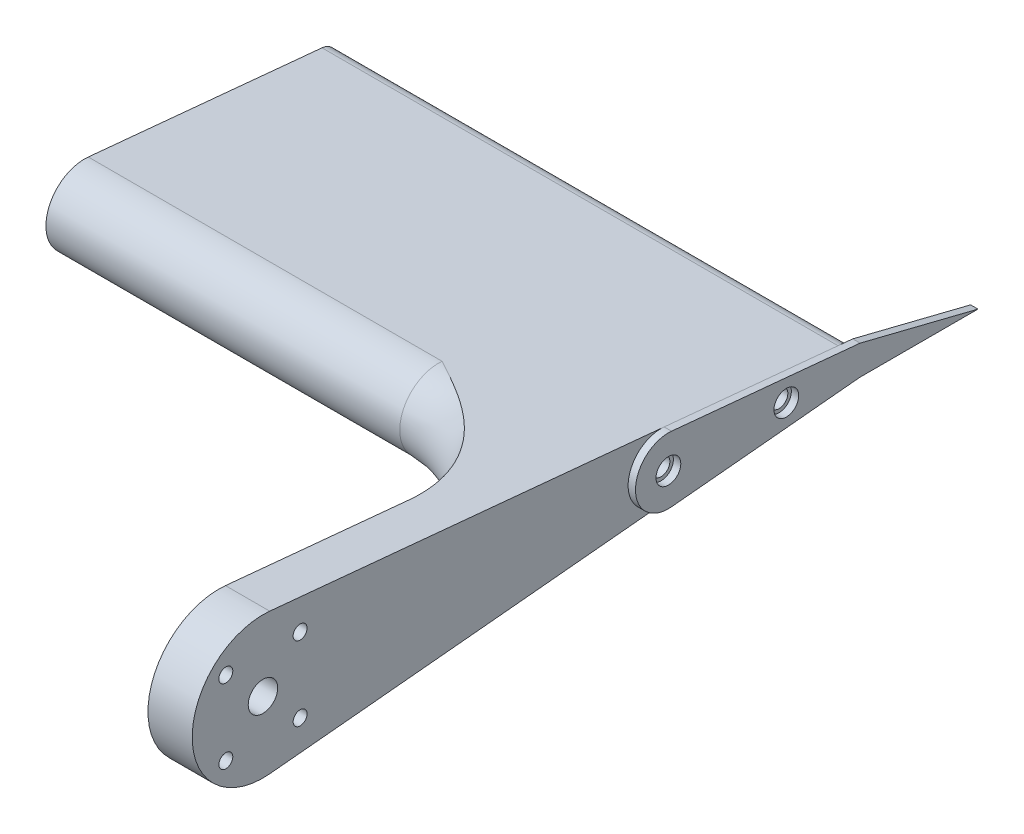
from build123d import *

# Parameters (mm, degrees)
SKETCH1_R           = 3.175
SKETCH1_R_2         = 1.4999999999999996
SKETCH1_R_3         = 1.4999999999999987
BOSS_EXTRUDE1_DEPTH = 4.7625
BOSS_EXTRUDE2_DEPTH = 101.6
SKETCH4_R           = 2.6669999999999963
BOSS_EXTRUDE3_DEPTH = 1.5875
SKETCH5_R           = 1.9050000000000071
CUT_EXTRUDE1_DEPTH  = 25.4
FILLET1_R           = 25.4


with BuildPart() as part:
    # Sketch1 → Boss-Extrude1 (new, symmetric)
    with BuildSketch(Plane(origin=(0, 0, 0), x_dir=(0, 0, -1), z_dir=(1, 0, 0))):
        with BuildLine():
            Line((1.449527282604434, 15.170908695822588), (123.83939402170368, 3.476984850542586))
            ThreePointArc((123.83939402170368, 3.476984850542586), (127.00000000000004, 0), (123.83939402170368, -3.476984850542586))
            Line((123.83939402170368, -3.476984850542586), (1.449527282604434, -15.170908695822588))
            ThreePointArc((1.449527282604434, -15.170908695822588), (-15.24, 1.87e-15), (1.449527282604434, 15.170908695822588))
        make_face()
        with Locations(Location((0, 0, 0), (0, 0, 180))):
            Circle(SKETCH1_R, mode=Mode.SUBTRACT)
        with Locations(Location((-8.000000000000005, 8.000000000000002, 0), (0, 0, 180))):
            Circle(SKETCH1_R_2, mode=Mode.SUBTRACT)
        with Locations(Location((7.999999999999998, 8.000000000000002, 0), (0, 0, 180))):
            Circle(SKETCH1_R_3, mode=Mode.SUBTRACT)
        with Locations(Location((7.999999999999998, -7.999999999999998, 0), (0, 0, 180))):
            Circle(SKETCH1_R_3, mode=Mode.SUBTRACT)
        with Locations(Location((-8.000000000000002, -7.999999999999998, 0), (0, 0, 180))):
            Circle(SKETCH1_R_2, mode=Mode.SUBTRACT)
    extrude(amount=BOSS_EXTRUDE1_DEPTH, both=True)

    # Sketch3 → Boss-Extrude2 (add)
    with BuildSketch(Plane.ZY.offset(4.7625)):
        with BuildLine():
            Line((-73.49895861991335, 8.286837443826865), (-123.83939402170368, 3.476984850542586))
            ThreePointArc((-123.83939402170368, 3.476984850542586), (-127.00000000000004, 4.3e-16), (-123.83939402170368, -3.476984850542586))
            Line((-123.83939402170368, -3.476984850542586), (-73.49895861991335, -8.286837443826865))
            ThreePointArc((-73.49895861991335, -8.286837443826865), (-64.38260294351677, 0), (-73.49895861991335, 8.286837443826865))
        make_face()
    extrude(amount=BOSS_EXTRUDE2_DEPTH)

    # Sketch5 → Cut-Extrude1 (cut)
    with BuildSketch(Plane(origin=(4.7625, 0, 0), x_dir=(0, 0, -1), z_dir=(1, 0, 0))):
        with Locations((85.72500000000001, 0)):
            Circle(SKETCH5_R)
        with Locations((111.125, 0)):
            Circle(SKETCH5_R)
    extrude(amount=-CUT_EXTRUDE1_DEPTH, mode=Mode.SUBTRACT)

    # Fillet1
    fillet1_edges = [part.edges().sort_by_distance(p)[0] for p in [
        (-4.7625, 4.4e-16, -64.38260294351677),
    ]]
    fillet(fillet1_edges, radius=FILLET1_R)


with BuildPart() as body_2:
    # Sketch4 → Boss-Extrude3 (new body)
    with BuildSketch(Plane(origin=(4.7625, 0, 0), x_dir=(0, 0, -1), z_dir=(1, 0, 0))):
        with BuildLine():
            Line((127, 3.175), (152.4, -3.174999999999997))
            Line((152.4, -3.174999999999997), (127, -3.175))
            Line((127, -3.175), (86.39901202312564, -7.054282444655376))
            ThreePointArc((86.39901202312564, -7.054282444655376), (78.63859096464995, -8.7e-16), (86.39901202312564, 7.05428244465537))
            Line((86.39901202312564, 7.05428244465537), (127, 3.175))
        make_face()
        with Locations((111.125, 0)):
            Circle(SKETCH4_R, mode=Mode.SUBTRACT)
        with Locations((85.72500000000001, 0)):
            Circle(SKETCH4_R, mode=Mode.SUBTRACT)
    extrude(amount=BOSS_EXTRUDE3_DEPTH)


solid = Compound([part.part, body_2.part])
